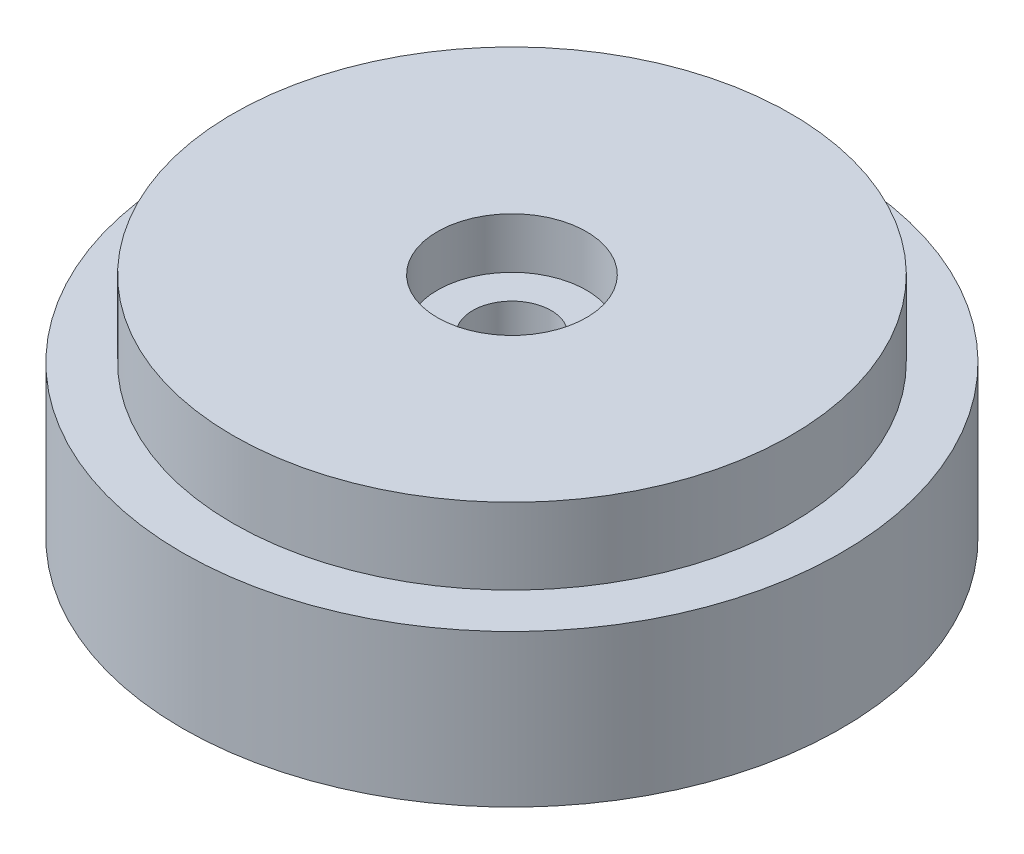
from build123d import *

# Parameters (mm, degrees)
SKETCH2_R           = 11
SKETCH2_R_2         = 2.94
BOSS_EXTRUDE1_DEPTH = 9
SKETCH2_3_R         = 2.94
SKETCH2_3_R_2       = 1.55
BOSS_EXTRUDE2_DEPTH = 7
SKETCH2_4_R         = 2.94
SKETCH2_4_R_2       = 1.55
CUT_EXTRUDE1_DEPTH  = 3
SKETCH2_6_R         = 3.05
CUT_EXTRUDE2_DEPTH  = 8.6
SKETCH2_7_R         = 13
SKETCH2_7_R_2       = 11
BOSS_EXTRUDE3_DEPTH = 6


with BuildPart() as part:
    # Sketch2 → Boss-Extrude1 (new body)
    with BuildSketch(Plane(origin=(0, 0, 0), x_dir=(1, 0, 0), z_dir=(0, 1, 0))):
        Circle(SKETCH2_R)
        Circle(SKETCH2_R_2, mode=Mode.SUBTRACT)
    extrude(amount=BOSS_EXTRUDE1_DEPTH)

    # Sketch2<3> → Boss-Extrude2 (add)
    with BuildSketch(Plane(origin=(0, 0, 0), x_dir=(1, 0, 0), z_dir=(0, 1, 0))):
        Circle(SKETCH2_3_R)
        Circle(SKETCH2_3_R_2, mode=Mode.SUBTRACT)
    extrude(amount=BOSS_EXTRUDE2_DEPTH)

    # Sketch2<4> → Cut-Extrude1 (cut)
    with BuildSketch(Plane(origin=(0, 0, 0), x_dir=(1, 0, 0), z_dir=(0, 1, 0))):
        Circle(SKETCH2_4_R)
        Circle(SKETCH2_4_R_2, mode=Mode.SUBTRACT)
    extrude(amount=CUT_EXTRUDE1_DEPTH, mode=Mode.SUBTRACT)

    # Sketch2<6> → Cut-Extrude2 (cut)
    with BuildSketch(Plane(origin=(0, 0, 0), x_dir=(1, 0, 0), z_dir=(0, 1, 0))):
        with Locations((-5, 5)):
            Circle(SKETCH2_6_R)
        with Locations((5, 5)):
            Circle(SKETCH2_6_R)
        with Locations((5, -5)):
            Circle(SKETCH2_6_R)
        with Locations((-5, -5)):
            Circle(SKETCH2_6_R)
    extrude(amount=CUT_EXTRUDE2_DEPTH, mode=Mode.SUBTRACT)

    # Sketch2<7> → Boss-Extrude3 (add)
    with BuildSketch(Plane(origin=(0, 0, 0), x_dir=(1, 0, 0), z_dir=(0, 1, 0))):
        Circle(SKETCH2_7_R)
        Circle(SKETCH2_7_R_2, mode=Mode.SUBTRACT)
    extrude(amount=BOSS_EXTRUDE3_DEPTH)


solid = part.part
